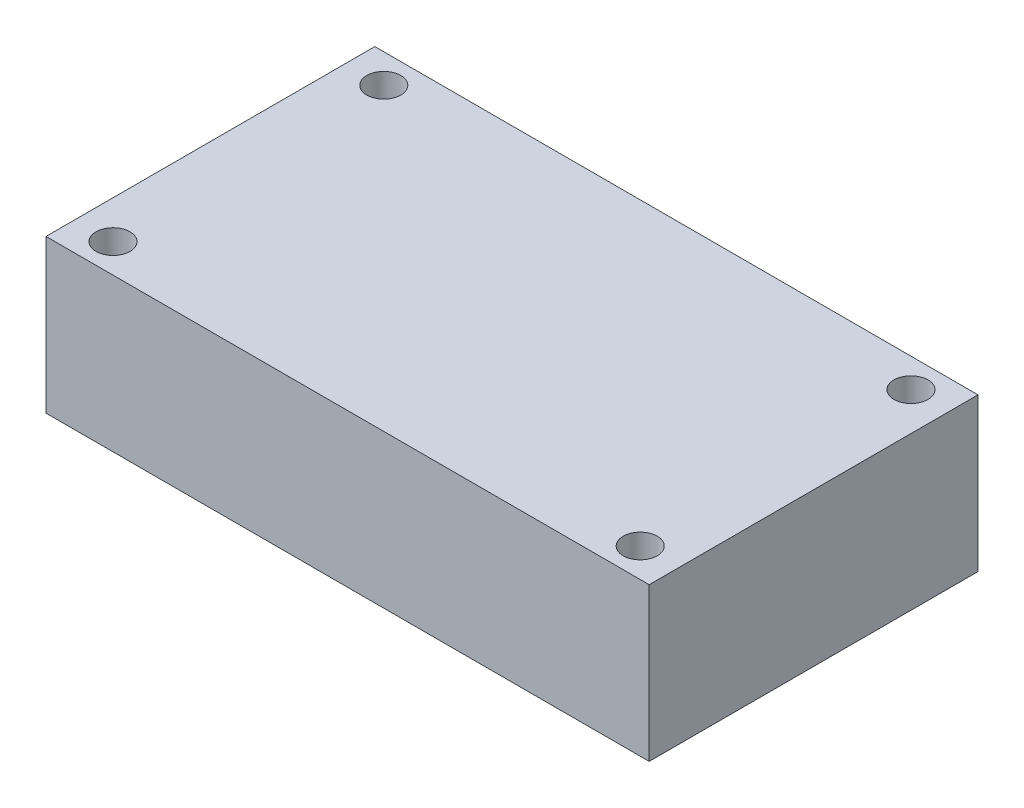
from build123d import *

# Parameters (mm, degrees)
SKETCH_1_W          = 53.2
SKETCH_1_H          = 29
EXTRUDE_1_DEPTH     = 13.5
SKETCH_2_R          = 1.5
CUT_EXTRUDE_1_DEPTH = 50


with BuildPart() as part:
    # Эскиз1 → Бобышка-Вытянуть1 (new body)
    with BuildSketch(Plane(origin=(0, 0, 0), x_dir=(1, 0, 0), z_dir=(0, 1, 0))):
        Rectangle(SKETCH_1_W, SKETCH_1_H)
    extrude(amount=EXTRUDE_1_DEPTH)

    # Эскиз2 → Вырез-Вытянуть1 (cut)
    with BuildSketch(Plane.XZ):
        with Locations(Location((-23.25, 11.94, 0), (0, 0, 270))):
            Circle(SKETCH_2_R)
        with Locations(Location((23.25, 11.94, 0), (0, 0, 270))):
            Circle(SKETCH_2_R)
        with Locations(Location((23.25, -11.94, 0), (0, 0, 270))):
            Circle(SKETCH_2_R)
        with Locations(Location((-23.25, -11.94, 0), (0, 0, 270))):
            Circle(SKETCH_2_R)
    extrude(amount=-CUT_EXTRUDE_1_DEPTH, mode=Mode.SUBTRACT)


solid = part.part
